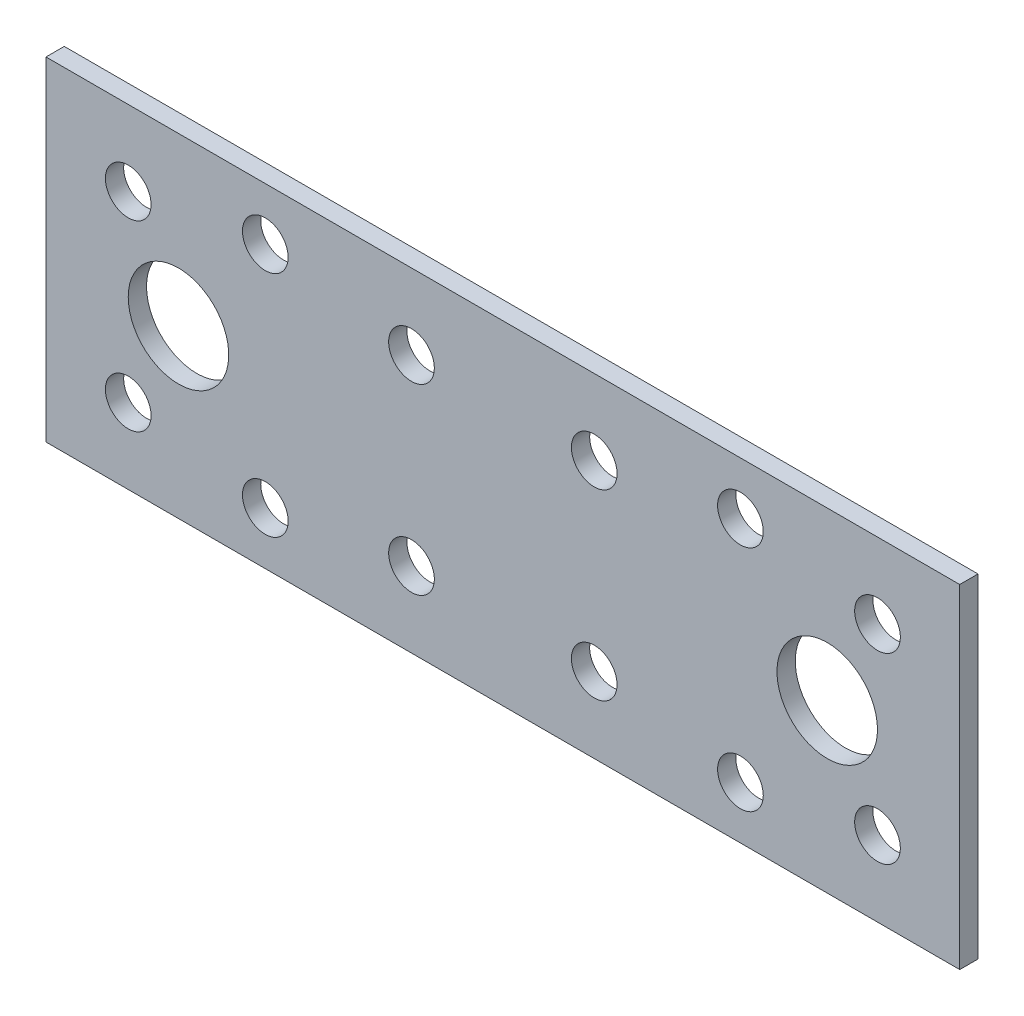
from build123d import *

# Parameters (mm, degrees)
SKETCH_1_W      = 100
SKETCH_1_H      = 36.5
SKETCH_1_R      = 5.5
SKETCH_1_R_2    = 2.5
EXTRUDE_1_DEPTH = 2


with BuildPart() as part:
    # Эскиз1 → Вытянуть1 (new body)
    with BuildSketch(Plane.XY):
        Rectangle(SKETCH_1_W, SKETCH_1_H)
        with Locations((35.5, 0)):
            Circle(SKETCH_1_R, mode=Mode.SUBTRACT)
        with Locations(Location((-35.5, 0, 0), (0, 0, 180))):
            Circle(SKETCH_1_R, mode=Mode.SUBTRACT)
        with Locations((-41, 10)):
            Circle(SKETCH_1_R_2, mode=Mode.SUBTRACT)
        with Locations((-26, 12.5)):
            Circle(SKETCH_1_R_2, mode=Mode.SUBTRACT)
        with Locations((-10, 10)):
            Circle(SKETCH_1_R_2, mode=Mode.SUBTRACT)
        with Locations(Location((-10, -10, 0), (0, 0, 180))):
            Circle(SKETCH_1_R_2, mode=Mode.SUBTRACT)
        with Locations(Location((-26, -12.5, 0), (0, 0, 180))):
            Circle(SKETCH_1_R_2, mode=Mode.SUBTRACT)
        with Locations(Location((-41, -10, 0), (0, 0, 180))):
            Circle(SKETCH_1_R_2, mode=Mode.SUBTRACT)
        with Locations(Location((10, 10, 0), (0, 0, 180))):
            Circle(SKETCH_1_R_2, mode=Mode.SUBTRACT)
        with Locations((10, -10)):
            Circle(SKETCH_1_R_2, mode=Mode.SUBTRACT)
        with Locations((26, -12.5)):
            Circle(SKETCH_1_R_2, mode=Mode.SUBTRACT)
        with Locations(Location((26, 12.5, 0), (0, 0, 180))):
            Circle(SKETCH_1_R_2, mode=Mode.SUBTRACT)
        with Locations(Location((41, 10, 0), (0, 0, 180))):
            Circle(SKETCH_1_R_2, mode=Mode.SUBTRACT)
        with Locations((41, -10)):
            Circle(SKETCH_1_R_2, mode=Mode.SUBTRACT)
    extrude(amount=EXTRUDE_1_DEPTH)


solid = part.part
